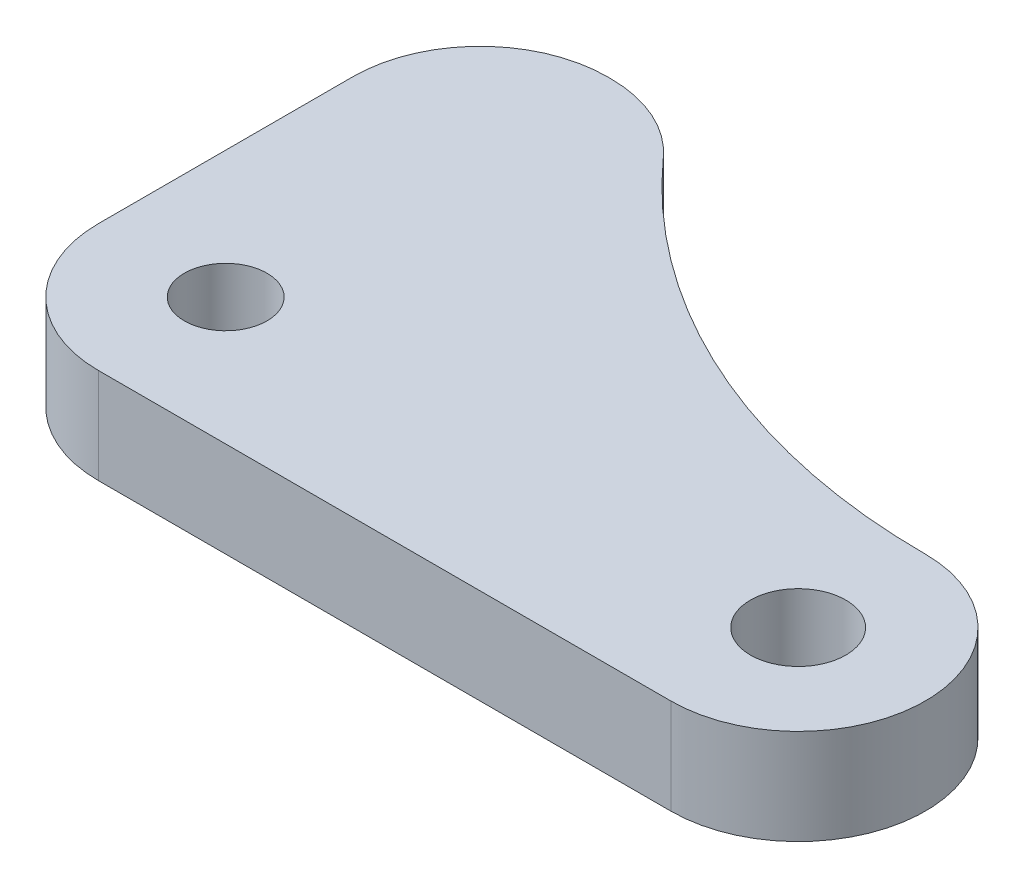
from build123d import *

# Parameters (mm, degrees)
RESSALTO_EXTRUS_O1_DEPTH     = 3
FURO_DE_DI_METRO_3_0_3_1_D   = 3
FURO_DE_DI_METRO_2_6_2_6_1_D = 2.6


with BuildPart() as part:
    # Esboço1 → Ressalto-extrusão1 (new body)
    with BuildSketch(Plane(origin=(0, 0, 0), x_dir=(1, 0, 0), z_dir=(0, 1, 0))):
        with BuildLine():
            Line((-9, -4), (9, -4))
            ThreePointArc((9, -4), (13, 0), (9, 4))
            ThreePointArc((9, 4), (0.835034191, 5.742581416), (-5.90711985, 10.666666667))
            ThreePointArc((-5.90711985, 10.666666667), (-7.255550658, 11.651483717), (-8.88854382, 12))
            Line((-8.88854382, 12), (-9, 12))
            ThreePointArc((-9, 12), (-11.828427125, 10.828427125), (-13, 8))
            Line((-13, 8), (-13, 0))
            ThreePointArc((-13, 0), (-11.828427125, -2.828427125), (-9, -4))
        make_face()
    extrude(amount=RESSALTO_EXTRUS_O1_DEPTH)

    # Furo de diâmetro Ø3.0 (3)1 (through all)
    with Locations(Plane(origin=(0, 3, 0), x_dir=(1, 0, 0), z_dir=(0, 1, 0))):
        with Locations((9, 0)):
            Hole(FURO_DE_DI_METRO_3_0_3_1_D / 2)

    # Furo de diâmetro Ø2.6 (2.6)1 (through all)
    with Locations(Plane(origin=(0, 3, 0), x_dir=(1, 0, 0), z_dir=(0, 1, 0))):
        with Locations((-9, 0)):
            Hole(FURO_DE_DI_METRO_2_6_2_6_1_D / 2)


solid = part.part
